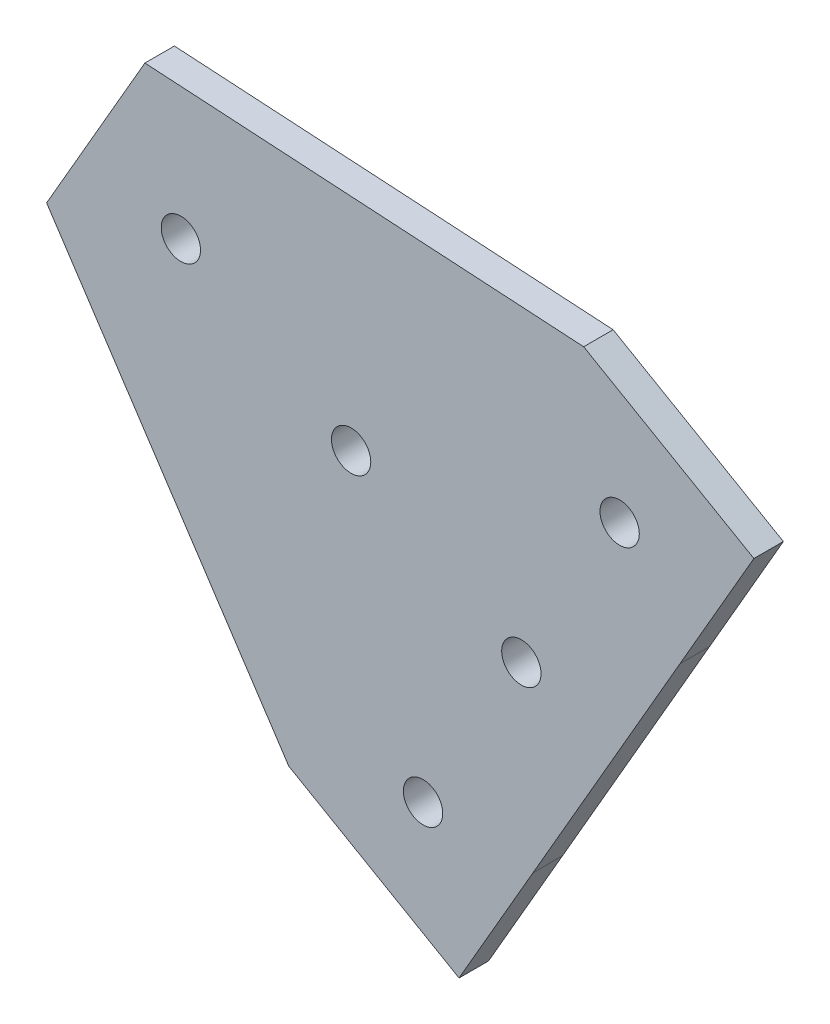
from build123d import *

# Parameters (mm, degrees)
SKETCH_1_R      = 2
EXTRUDE_1_DEPTH = 3


with BuildPart() as part:
    # 草图1 → 凸台-拉伸1 (new body)
    with BuildSketch(Plane.XY):
        with BuildLine():
            Line((14.263569054, -6.979512092), (29.170512591, 18.8400715))
            ThreePointArc((29.170512591, 18.8400715), (29.193213203, 18.880689143), (29.216290822, 18.921093774))
            Line((29.216290822, 18.921093774), (36.716290822, 31.91147483))
            Line((36.716290822, 31.91147483), (19.395782747, 41.91147483))
            Line((19.395782747, 41.91147483), (-25.245233405, 44.590966755))
            Line((-25.245233405, 44.590966755), (-35.245233405, 27.270458679))
            Line((-35.245233405, 27.270458679), (-10.604217253, -10.050049397))
            Line((-10.604217253, -10.050049397), (6.716290822, -20.050049397))
            Line((6.716290822, -20.050049397), (14.216290822, -7.05966834))
            ThreePointArc((14.216290822, -7.05966834), (14.23974345, -7.01948022), (14.263569054, -6.979512092))
        make_face()
        with Locations((-21.584979367, 30.930712717)):
            Circle(SKETCH_1_R, mode=Mode.SUBTRACT)
        with Locations((3.056036785, -6.389795359)):
            Circle(SKETCH_1_R, mode=Mode.SUBTRACT)
        with Locations((13.056036785, 10.930712717)):
            Circle(SKETCH_1_R, mode=Mode.SUBTRACT)
        with Locations((23.056036785, 28.251220792)):
            Circle(SKETCH_1_R, mode=Mode.SUBTRACT)
        with Locations((-4.264471291, 20.930712717)):
            Circle(SKETCH_1_R, mode=Mode.SUBTRACT)
    extrude(amount=EXTRUDE_1_DEPTH)


solid = part.part
